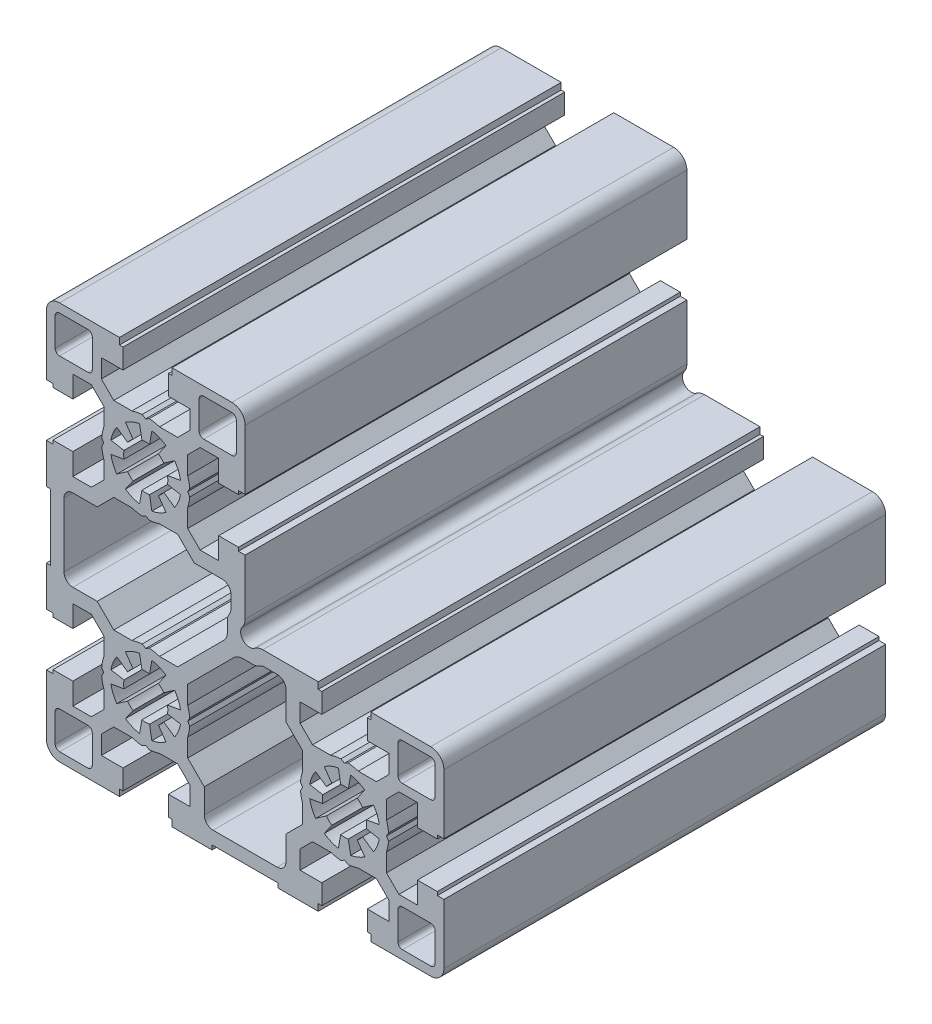
from build123d import *

# Parameters (mm, degrees)
EXTRUDE_1_DEPTH = 100


with BuildPart() as part:
    # Model → Бобышка-Вытянуть1 (new body)
    with BuildSketch(Plane.XY):
        with BuildLine():
            Line((38.010050507, -18.339949491), (42.510050507, -18.339949491))
            Line((42.510050507, -18.339949491), (42.510050507, -17.539949491))
            Line((42.510050507, -17.539949491), (44.010050496, -17.539949491))
            Line((44.010050496, -17.539949491), (44.010050496, -3.989729723))
            ThreePointArc((44.010050496, -3.989729723), (43.131293145, -1.868551453), (41.010050504, -0.989949496))
            Line((41.010050504, -0.989949496), (27.460050496, -0.989949496))
            Line((27.460050496, -0.989949496), (27.460050496, -2.489949483))
            Line((27.460050496, -2.489949483), (26.660050495, -2.489949483))
            Line((26.660050495, -2.489949483), (26.660050495, -6.989949483))
            Line((26.660050495, -6.989949483), (31.560050509, -6.989949483))
            Line((31.560050509, -6.989949483), (31.560050509, -11.177207783))
            Line((31.560050509, -11.177207783), (28.747308809, -13.989949483))
            Line((28.747308809, -13.989949483), (24.632549509, -13.989949483))
            ThreePointArc((24.632549509, -13.989949483), (23.489741508, -13.68786687), (22.319271998, -13.522745231))
            Line((22.319271998, -13.522745231), (21.510050499, -13.989949481))
            Line((21.510050499, -13.989949481), (20.700829, -13.522745231))
            ThreePointArc((20.700829, -13.522745231), (19.530359499, -13.687866869), (18.387551508, -13.989949479))
            Line((18.387551508, -13.989949479), (14.272792208, -13.989949479))
            Line((14.272792208, -13.989949479), (11.460050508, -11.177207779))
            Line((11.460050508, -11.177207779), (11.460050508, -6.989949479))
            Line((11.460050508, -6.989949479), (16.360050501, -6.989949479))
            Line((16.360050501, -6.989949479), (16.360050501, -2.489949483))
            Line((16.360050501, -2.489949483), (15.560050496, -2.489949483))
            Line((15.560050496, -2.489949483), (15.560050496, -0.989949496))
            Line((15.560050496, -0.989949496), (3.013354114, -0.989949496))
            ThreePointArc((3.013354114, -0.989949496), (2.059915363, -1.14548917), (1.205341646, -1.595979799))
            ThreePointArc((1.205341646, -1.595979799), (-1.414213563, -1.414213562), (-1.595979798, 1.205341647))
            ThreePointArc((-1.595979798, 1.205341647), (-1.145489169, 2.059915365), (-0.989949495, 3.013354117))
            Line((-0.989949495, 3.013354117), (-0.989949495, 15.560050504))
            Line((-0.989949495, 15.560050504), (-2.489949491, 15.560050504))
            Line((-2.489949491, 15.560050504), (-2.489949491, 16.360050504))
            Line((-2.489949491, 16.360050504), (-6.989949491, 16.360050504))
            Line((-6.989949491, 16.360050504), (-6.989949491, 11.460050507))
            Line((-6.989949491, 11.460050507), (-11.177207795, 11.460050507))
            Line((-11.177207795, 11.460050507), (-13.989949495, 14.272792207))
            Line((-13.989949495, 14.272792207), (-13.989949495, 18.387551507))
            ThreePointArc((-13.989949495, 18.387551507), (-13.687866882, 19.530359507), (-13.522745244, 20.700829017))
            Line((-13.522745244, 20.700829017), (-13.989949494, 21.510050516))
            Line((-13.989949494, 21.510050516), (-13.522745244, 22.319272015))
            ThreePointArc((-13.522745244, 22.319272015), (-13.687866882, 23.489741516), (-13.989949493, 24.632549507))
            Line((-13.989949493, 24.632549507), (-13.989949493, 28.747308807))
            Line((-13.989949493, 28.747308807), (-11.177207793, 31.560050507))
            Line((-11.177207793, 31.560050507), (-6.989949493, 31.560050507))
            Line((-6.989949493, 31.560050507), (-6.989949493, 26.660050503))
            Line((-6.989949493, 26.660050503), (-2.489949489, 26.660050503))
            Line((-2.489949489, 26.660050503), (-2.489949489, 27.460050504))
            Line((-2.489949489, 27.460050504), (-0.989949496, 27.460050504))
            Line((-0.989949496, 27.460050504), (-0.989949496, 41.010050504))
            ThreePointArc((-0.989949496, 41.010050504), (-1.868629152, 43.131370847), (-3.989949496, 44.010050504))
            Line((-3.989949496, 44.010050504), (-17.539949496, 44.010050504))
            Line((-17.539949496, 44.010050504), (-17.539949496, 42.510050507))
            Line((-17.539949496, 42.510050507), (-18.339949496, 42.510050507))
            Line((-18.339949496, 42.510050507), (-18.339949496, 38.010050507))
            Line((-18.339949496, 38.010050507), (-13.439949492, 38.010050507))
            Line((-13.439949492, 38.010050507), (-13.439949492, 33.822792209))
            Line((-13.439949492, 33.822792209), (-16.252691192, 31.010050509))
            Line((-16.252691192, 31.010050509), (-20.36745051, 31.010050509))
            ThreePointArc((-20.36745051, 31.010050509), (-21.510258502, 31.312133119), (-22.680728004, 31.477254755))
            Line((-22.680728004, 31.477254755), (-23.489949502, 31.010050505))
            Line((-23.489949502, 31.010050505), (-24.299171001, 31.477254755))
            ThreePointArc((-24.299171001, 31.477254755), (-25.469640502, 31.312133117), (-26.612448493, 31.010050506))
            Line((-26.612448493, 31.010050506), (-30.727207793, 31.010050506))
            Line((-30.727207793, 31.010050506), (-33.539949493, 33.822792206))
            Line((-33.539949493, 33.822792206), (-33.539949493, 38.010050506))
            Line((-33.539949493, 38.010050506), (-28.639949493, 38.010050506))
            Line((-28.639949493, 38.010050506), (-28.639949493, 42.510050507))
            Line((-28.639949493, 42.510050507), (-29.439949496, 42.510050507))
            Line((-29.439949496, 42.510050507), (-29.439949496, 44.010050504))
            Line((-29.439949496, 44.010050504), (-42.989949496, 44.010050504))
            ThreePointArc((-42.989949496, 44.010050504), (-45.111269839, 43.131370847), (-45.989949496, 41.010050504))
            Line((-45.989949496, 41.010050504), (-45.989949496, 27.460050504))
            Line((-45.989949496, 27.460050504), (-44.489949499, 27.460050504))
            Line((-44.489949499, 27.460050504), (-44.489949499, 26.660050503))
            Line((-44.489949499, 26.660050503), (-39.989949499, 26.660050503))
            Line((-39.989949499, 26.660050503), (-39.989949499, 31.560050507))
            Line((-39.989949499, 31.560050507), (-35.802691195, 31.560050507))
            Line((-35.802691195, 31.560050507), (-32.989949495, 28.747308807))
            Line((-32.989949495, 28.747308807), (-32.989949495, 24.632549507))
            ThreePointArc((-32.989949495, 24.632549507), (-33.292032106, 23.489741516), (-33.457153745, 22.319272015))
            Line((-33.457153745, 22.319272015), (-32.989949494, 21.510050516))
            Line((-32.989949494, 21.510050516), (-33.457153745, 20.700829017))
            ThreePointArc((-33.457153745, 20.700829017), (-33.292032106, 19.530359507), (-32.989949493, 18.387551507))
            Line((-32.989949493, 18.387551507), (-32.989949493, 14.272792207))
            Line((-32.989949493, 14.272792207), (-35.802691193, 11.460050507))
            Line((-35.802691193, 11.460050507), (-39.989949497, 11.460050507))
            Line((-39.989949497, 11.460050507), (-39.989949497, 16.360050504))
            Line((-39.989949497, 16.360050504), (-44.4899495, 16.360050504))
            Line((-44.4899495, 16.360050504), (-44.4899495, 15.560050504))
            Line((-44.4899495, 15.560050504), (-45.989949497, 15.560050504))
            Line((-45.989949497, 15.560050504), (-45.989949497, 6.510050501))
            Line((-45.989949497, 6.510050501), (-44.989949496, 6.510050501))
            Line((-44.989949496, 6.510050501), (-44.989949496, -8.489949499))
            Line((-44.989949496, -8.489949499), (-45.989949496, -8.489949499))
            Line((-45.989949496, -8.489949499), (-45.989949496, -17.539949502))
            Line((-45.989949496, -17.539949502), (-44.4899495, -17.539949502))
            Line((-44.4899495, -17.539949502), (-44.4899495, -18.339949502))
            Line((-44.4899495, -18.339949502), (-39.9899495, -18.339949502))
            Line((-39.9899495, -18.339949502), (-39.9899495, -13.439949499))
            Line((-39.9899495, -13.439949499), (-35.802691196, -13.439949499))
            Line((-35.802691196, -13.439949499), (-32.989949496, -16.252691199))
            Line((-32.989949496, -16.252691199), (-32.989949496, -20.367450499))
            ThreePointArc((-32.989949496, -20.367450499), (-33.292604606, -21.510173501), (-33.457584039, -22.680727968))
            Line((-33.457584039, -22.680727968), (-32.990379788, -23.489949467))
            Line((-32.990379788, -23.489949467), (-33.457584039, -24.299170966))
            ThreePointArc((-33.457584039, -24.299170966), (-33.292326001, -25.470315713), (-32.989949495, -26.613757309))
            Line((-32.989949495, -26.613757309), (-32.989949495, -30.727207799))
            Line((-32.989949495, -30.727207799), (-35.802691195, -33.539949499))
            Line((-35.802691195, -33.539949499), (-39.989949499, -33.539949499))
            Line((-39.989949499, -33.539949499), (-39.989949499, -28.639949501))
            Line((-39.989949499, -28.639949501), (-44.489949499, -28.639949501))
            Line((-44.489949499, -28.639949501), (-44.489949499, -29.439949502))
            Line((-44.489949499, -29.439949502), (-45.989949496, -29.439949502))
            Line((-45.989949496, -29.439949502), (-45.989949496, -42.989949496))
            ThreePointArc((-45.989949496, -42.989949496), (-45.111269839, -45.11126984), (-42.989949496, -45.989949496))
            Line((-42.989949496, -45.989949496), (-29.439949498, -45.989949496))
            Line((-29.439949498, -45.989949496), (-29.439949498, -44.489949503))
            Line((-29.439949498, -44.489949503), (-28.639949497, -44.489949503))
            Line((-28.639949497, -44.489949503), (-28.639949497, -39.989949499))
            Line((-28.639949497, -39.989949499), (-33.539949492, -39.989949499))
            Line((-33.539949492, -39.989949499), (-33.539949492, -35.802691195))
            Line((-33.539949492, -35.802691195), (-30.727207792, -32.989949495))
            Line((-30.727207792, -32.989949495), (-26.612448492, -32.989949495))
            ThreePointArc((-26.612448492, -32.989949495), (-25.469640502, -33.292032106), (-24.299171002, -33.457153745))
            Line((-24.299171002, -33.457153745), (-23.489949503, -32.989949494))
            Line((-23.489949503, -32.989949494), (-22.680728005, -33.457153745))
            ThreePointArc((-22.680728005, -33.457153745), (-21.510258513, -33.29203211), (-20.367450531, -32.989949505))
            Line((-20.367450531, -32.989949505), (-16.252691194, -32.989949505))
            Line((-16.252691194, -32.989949505), (-13.439949494, -35.802691205))
            Line((-13.439949494, -35.802691205), (-13.439949494, -39.989949509))
            Line((-13.439949494, -39.989949509), (-18.339949497, -39.989949509))
            Line((-18.339949497, -39.989949509), (-18.339949497, -44.489949509))
            Line((-18.339949497, -44.489949509), (-17.539949497, -44.489949509))
            Line((-17.539949497, -44.489949509), (-17.539949497, -45.989949505))
            Line((-17.539949497, -45.989949505), (-8.489949494, -45.989949505))
            Line((-8.489949494, -45.989949505), (-8.489949494, -44.989949505))
            Line((-8.489949494, -44.989949505), (6.510050506, -44.989949505))
            Line((6.510050506, -44.989949505), (6.510050506, -45.989949505))
            Line((6.510050506, -45.989949505), (15.560050497, -45.989949505))
            Line((15.560050497, -45.989949505), (15.560050497, -44.489949508))
            Line((15.560050497, -44.489949508), (16.360050497, -44.489949508))
            Line((16.360050497, -44.489949508), (16.360050497, -39.989949477))
            Line((16.360050497, -39.989949477), (11.460050508, -39.989949477))
            Line((11.460050508, -39.989949477), (11.460050508, -35.802691177))
            Line((11.460050508, -35.802691177), (14.272792208, -32.989949477))
            Line((14.272792208, -32.989949477), (18.387551508, -32.989949477))
            ThreePointArc((18.387551508, -32.989949477), (19.530358922, -33.29203497), (20.70082901, -33.457153726))
            Line((20.70082901, -33.457153726), (21.510050509, -32.989949476))
            Line((21.510050509, -32.989949476), (22.319272008, -33.457153726))
            ThreePointArc((22.319272008, -33.457153726), (23.489741505, -33.292032088), (24.632549493, -32.989949479))
            Line((24.632549493, -32.989949479), (28.747308808, -32.989949479))
            Line((28.747308808, -32.989949479), (31.560050508, -35.802691179))
            Line((31.560050508, -35.802691179), (31.560050508, -39.989949504))
            Line((31.560050508, -39.989949504), (26.660050495, -39.989949504))
            Line((26.660050495, -39.989949504), (26.660050495, -44.489949499))
            Line((26.660050495, -44.489949499), (27.460050496, -44.489949499))
            Line((27.460050496, -44.489949499), (27.460050496, -45.989949496))
            Line((27.460050496, -45.989949496), (41.010050504, -45.989949496))
            ThreePointArc((41.010050504, -45.989949496), (43.131370848, -45.11126984), (44.010050504, -42.989949496))
            Line((44.010050504, -42.989949496), (44.010050504, -29.439949491))
            Line((44.010050504, -29.439949491), (42.510050506, -29.439949491))
            Line((42.510050506, -29.439949491), (42.510050506, -28.63994949))
            Line((42.510050506, -28.63994949), (38.01005051, -28.63994949))
            Line((38.01005051, -28.63994949), (38.01005051, -33.53994948))
            Line((38.01005051, -33.53994948), (33.82279221, -33.53994948))
            Line((33.82279221, -33.53994948), (31.01005051, -30.72720778))
            Line((31.01005051, -30.72720778), (31.01005051, -26.61244848))
            ThreePointArc((31.01005051, -26.61244848), (31.312133122, -25.469640479), (31.477254759, -24.299170968))
            Line((31.477254759, -24.299170968), (31.010050509, -23.489949469))
            Line((31.010050509, -23.489949469), (31.477254759, -22.68072797))
            ThreePointArc((31.477254759, -22.68072797), (31.312133119, -21.51025847), (31.010050507, -20.367450479))
            Line((31.010050507, -20.367450479), (31.010050507, -16.252691179))
            Line((31.010050507, -16.252691179), (33.822792207, -13.439949479))
            Line((33.822792207, -13.439949479), (38.010050507, -13.439949479))
            Line((38.010050507, -13.439949479), (38.010050507, -18.339949491))
        make_face()
        with BuildLine():
            Line((41.010050504, -11.389949496), (34.610050504, -11.389949496))
            ThreePointArc((34.610050504, -11.389949496), (33.902943723, -11.097056278), (33.610050504, -10.389949496))
            Line((33.610050504, -10.389949496), (33.610050504, -3.989949496))
            ThreePointArc((33.610050504, -3.989949496), (33.902943723, -3.282842715), (34.610050504, -2.989949496))
            Line((34.610050504, -2.989949496), (41.010050504, -2.989949496))
            ThreePointArc((41.010050504, -2.989949496), (41.717157285, -3.282842715), (42.010050504, -3.989949496))
            Line((42.010050504, -3.989949496), (42.010050504, -10.389949496))
            ThreePointArc((42.010050504, -10.389949496), (41.717157285, -11.097056278), (41.010050504, -11.389949496))
        make_face(mode=Mode.SUBTRACT)
        with BuildLine():
            Line((-43.989949496, -42.989949496), (-43.989949496, -36.589949496))
            ThreePointArc((-43.989949496, -36.589949496), (-43.697056277, -35.882842715), (-42.989949496, -35.589949496))
            Line((-42.989949496, -35.589949496), (-36.589949496, -35.589949496))
            ThreePointArc((-36.589949496, -35.589949496), (-35.882842715, -35.882842715), (-35.589949496, -36.589949496))
            Line((-35.589949496, -36.589949496), (-35.589949496, -42.989949496))
            ThreePointArc((-35.589949496, -42.989949496), (-35.882842715, -43.697056278), (-36.589949496, -43.989949496))
            Line((-36.589949496, -43.989949496), (-42.989949496, -43.989949496))
            ThreePointArc((-42.989949496, -43.989949496), (-43.697056277, -43.697056278), (-43.989949496, -42.989949496))
        make_face(mode=Mode.SUBTRACT)
        with BuildLine():
            Line((-19.394189275, -20.622067323), (-16.936733145, -18.901338013))
            ThreePointArc((-16.936733145, -18.901338013), (-16.098913239, -20.428482045), (-15.611487474, -22.100764083))
            Line((-15.611487474, -22.100764083), (-18.565910735, -22.621708613))
            ThreePointArc((-18.565910735, -22.621708613), (-18.489949499, -23.489949503), (-18.565910735, -24.358190393))
            Line((-18.565910735, -24.358190393), (-15.611487475, -24.879134923))
            ThreePointArc((-15.611487475, -24.879134923), (-16.098913239, -26.551416961), (-16.936733145, -28.078560993))
            Line((-16.936733145, -28.078560993), (-19.394189275, -26.357831683))
            ThreePointArc((-19.394189275, -26.357831683), (-19.95441559, -27.025483407), (-20.622067315, -27.585709723))
            Line((-20.622067315, -27.585709723), (-18.901338005, -30.043165853))
            ThreePointArc((-18.901338005, -30.043165853), (-20.428482037, -30.880985759), (-22.100764075, -31.368411523))
            Line((-22.100764075, -31.368411523), (-22.621708605, -28.413988263))
            ThreePointArc((-22.621708605, -28.413988263), (-23.489949495, -28.489949498), (-24.358190385, -28.413988263))
            Line((-24.358190385, -28.413988263), (-24.879134915, -31.368411523))
            ThreePointArc((-24.879134915, -31.368411523), (-26.551416953, -30.880985759), (-28.078560985, -30.043165853))
            Line((-28.078560985, -30.043165853), (-26.357831675, -27.585709723))
            ThreePointArc((-26.357831675, -27.585709723), (-27.025483399, -27.025483407), (-27.585709715, -26.357831683))
            Line((-27.585709715, -26.357831683), (-30.043165845, -28.078560993))
            ThreePointArc((-30.043165845, -28.078560993), (-30.880985751, -26.551416961), (-31.368411515, -24.879134923))
            Line((-31.368411515, -24.879134923), (-28.413988255, -24.358190393))
            ThreePointArc((-28.413988255, -24.358190393), (-28.48994949, -23.489949503), (-28.413988255, -22.621708613))
            Line((-28.413988255, -22.621708613), (-31.368411515, -22.100764083))
            ThreePointArc((-31.368411515, -22.100764083), (-30.880985751, -20.428482045), (-30.043165844, -18.901338013))
            Line((-30.043165844, -18.901338013), (-27.585709715, -20.622067323))
            ThreePointArc((-27.585709715, -20.622067323), (-27.025483399, -19.954415599), (-26.357831675, -19.394189283))
            Line((-26.357831675, -19.394189283), (-28.078560985, -16.936733153))
            ThreePointArc((-28.078560985, -16.936733153), (-26.551416953, -16.098913247), (-24.879134915, -15.611487483))
            Line((-24.879134915, -15.611487483), (-24.358190385, -18.565910743))
            ThreePointArc((-24.358190385, -18.565910743), (-23.489949495, -18.489949508), (-22.621708605, -18.565910743))
            Line((-22.621708605, -18.565910743), (-22.100764075, -15.611487483))
            ThreePointArc((-22.100764075, -15.611487483), (-20.428482037, -16.098913247), (-18.901338005, -16.936733153))
            Line((-18.901338005, -16.936733153), (-20.622067315, -19.394189283))
            ThreePointArc((-20.622067315, -19.394189283), (-19.95441559, -19.954415599), (-19.394189275, -20.622067323))
        make_face(mode=Mode.SUBTRACT)
        with BuildLine():
            Line((-10.389949496, 42.010050504), (-3.989949496, 42.010050504))
            ThreePointArc((-3.989949496, 42.010050504), (-3.282842715, 41.717157285), (-2.989949496, 41.010050504))
            Line((-2.989949496, 41.010050504), (-2.989949496, 34.610050504))
            ThreePointArc((-2.989949496, 34.610050504), (-3.282842715, 33.902943722), (-3.989949496, 33.610050504))
            Line((-3.989949496, 33.610050504), (-10.389949496, 33.610050504))
            ThreePointArc((-10.389949496, 33.610050504), (-11.097056277, 33.902943722), (-11.389949496, 34.610050504))
            Line((-11.389949496, 34.610050504), (-11.389949496, 41.010050504))
            ThreePointArc((-11.389949496, 41.010050504), (-11.097056277, 41.717157285), (-10.389949496, 42.010050504))
        make_face(mode=Mode.SUBTRACT)
        with BuildLine():
            Line((-20.622067313, 17.414290287), (-18.901338003, 14.956834157))
            ThreePointArc((-18.901338003, 14.956834157), (-20.428482035, 14.11901425), (-22.100764073, 13.631588486))
            Line((-22.100764073, 13.631588486), (-22.621708603, 16.586011747))
            ThreePointArc((-22.621708603, 16.586011747), (-23.489949493, 16.510050511), (-24.358190383, 16.586011747))
            Line((-24.358190383, 16.586011747), (-24.879134913, 13.631588487))
            ThreePointArc((-24.879134913, 13.631588487), (-26.551416951, 14.119014251), (-28.078560983, 14.956834157))
            Line((-28.078560983, 14.956834157), (-26.357831673, 17.414290287))
            ThreePointArc((-26.357831673, 17.414290287), (-27.025483398, 17.974516602), (-27.585709713, 18.642168327))
            Line((-27.585709713, 18.642168327), (-30.043165843, 16.921439017))
            ThreePointArc((-30.043165843, 16.921439017), (-30.880985749, 18.448583049), (-31.368411514, 20.120865087))
            Line((-31.368411514, 20.120865087), (-28.413988253, 20.641809617))
            ThreePointArc((-28.413988253, 20.641809617), (-28.489949489, 21.510050507), (-28.413988253, 22.378291397))
            Line((-28.413988253, 22.378291397), (-31.368411513, 22.899235927))
            ThreePointArc((-31.368411513, 22.899235927), (-30.880985749, 24.571517964), (-30.043165843, 26.098661996))
            Line((-30.043165843, 26.098661996), (-27.585709713, 24.377932687))
            ThreePointArc((-27.585709713, 24.377932687), (-27.025483398, 25.045584411), (-26.357831673, 25.605810727))
            Line((-26.357831673, 25.605810727), (-28.078560983, 28.063266857))
            ThreePointArc((-28.078560983, 28.063266857), (-26.551416951, 28.901086763), (-24.879134913, 29.388512527))
            Line((-24.879134913, 29.388512527), (-24.358190383, 26.434089267))
            ThreePointArc((-24.358190383, 26.434089267), (-23.489949493, 26.510050502), (-22.621708603, 26.434089267))
            Line((-22.621708603, 26.434089267), (-22.100764073, 29.388512527))
            ThreePointArc((-22.100764073, 29.388512527), (-20.428482035, 28.901086763), (-18.901338003, 28.063266856))
            Line((-18.901338003, 28.063266856), (-20.622067313, 25.605810727))
            ThreePointArc((-20.622067313, 25.605810727), (-19.954415589, 25.045584411), (-19.394189273, 24.377932687))
            Line((-19.394189273, 24.377932687), (-16.936733143, 26.098661997))
            ThreePointArc((-16.936733143, 26.098661997), (-16.098913237, 24.571517965), (-15.611487473, 22.899235927))
            Line((-15.611487473, 22.899235927), (-18.565910733, 22.378291397))
            ThreePointArc((-18.565910733, 22.378291397), (-18.489949498, 21.510050507), (-18.565910733, 20.641809617))
            Line((-18.565910733, 20.641809617), (-15.611487473, 20.120865087))
            ThreePointArc((-15.611487473, 20.120865087), (-16.098913237, 18.448583049), (-16.936733144, 16.921439017))
            Line((-16.936733144, 16.921439017), (-19.394189273, 18.642168327))
            ThreePointArc((-19.394189273, 18.642168327), (-19.954415589, 17.974516602), (-20.622067313, 17.414290287))
        make_face(mode=Mode.SUBTRACT)
        with BuildLine():
            Line((-42.989949496, 42.010050504), (-36.589949496, 42.010050504))
            ThreePointArc((-36.589949496, 42.010050504), (-35.882842715, 41.717157285), (-35.589949496, 41.010050504))
            Line((-35.589949496, 41.010050504), (-35.589949496, 34.610050504))
            ThreePointArc((-35.589949496, 34.610050504), (-35.882842715, 33.902943722), (-36.589949496, 33.610050504))
            Line((-36.589949496, 33.610050504), (-42.989949496, 33.610050504))
            ThreePointArc((-42.989949496, 33.610050504), (-43.697056277, 33.902943722), (-43.989949496, 34.610050504))
            Line((-43.989949496, 34.610050504), (-43.989949496, 41.010050504))
            ThreePointArc((-43.989949496, 41.010050504), (-43.697056277, 41.717157285), (-42.989949496, 42.010050504))
        make_face(mode=Mode.SUBTRACT)
        with BuildLine():
            Line((-13.989949499, -16.252691194), (-3.605887459, -5.868629154))
            ThreePointArc((-3.605887459, -5.868629154), (-2.632617412, -5.218310901), (-1.484567115, -4.9899495))
            Line((-1.484567115, -4.9899495), (0.92372853, -4.9899495))
            ThreePointArc((0.92372853, -4.9899495), (1.43706441, -4.922948795), (1.916006424, -4.726435774))
            Line((1.916006424, -4.726435774), (2.393708386, -4.453463218))
            ThreePointArc((2.393708386, -4.453463218), (2.8726504, -4.256950197), (3.38598628, -4.189949492))
            Line((3.38598628, -4.189949492), (6.259620203, -4.189949492))
            ThreePointArc((6.259620203, -4.189949492), (7.673833765, -4.775735929), (8.259620203, -6.189949489))
            Line((8.259620203, -6.189949489), (8.259620203, -12.502260889))
            Line((8.259620203, -12.502260889), (12.010050503, -16.252691189))
            Line((12.010050503, -16.252691189), (12.010050503, -20.367450489))
            ThreePointArc((12.010050503, -20.367450489), (11.707967892, -21.510258481), (11.542846253, -22.680727982))
            Line((11.542846253, -22.680727982), (12.010050503, -23.48994948))
            Line((12.010050503, -23.48994948), (11.542846253, -24.299170979))
            ThreePointArc((11.542846253, -24.299170979), (11.707967891, -25.46964049), (12.010050504, -26.61244849))
            Line((12.010050504, -26.61244849), (12.010050504, -30.727207793))
            Line((12.010050504, -30.727207793), (8.259620204, -34.477638093))
            Line((8.259620204, -34.477638093), (8.259620204, -39.989949493))
            ThreePointArc((8.259620204, -39.989949493), (7.673833767, -41.404163055), (6.259620204, -41.989949493))
            Line((6.259620204, -41.989949493), (-8.239949496, -41.989949493))
            ThreePointArc((-8.239949496, -41.989949493), (-9.654163058, -41.404163055), (-10.239949496, -39.989949493))
            Line((-10.239949496, -39.989949493), (-10.239949496, -34.477207793))
            Line((-10.239949496, -34.477207793), (-13.989949496, -30.727207793))
            Line((-13.989949496, -30.727207793), (-13.989949496, -26.612448493))
            ThreePointArc((-13.989949496, -26.612448493), (-13.687866884, -25.469640493), (-13.522745247, -24.299170983))
            Line((-13.522745247, -24.299170983), (-13.989949497, -23.489949484))
            Line((-13.989949497, -23.489949484), (-13.522745247, -22.680727985))
            ThreePointArc((-13.522745247, -22.680727985), (-13.687866887, -21.510258485), (-13.989949499, -20.367450494))
            Line((-13.989949499, -20.367450494), (-13.989949499, -16.252691194))
        make_face(mode=Mode.SUBTRACT)
        with BuildLine():
            Line((-23.489949495, -13.989949503), (-24.299170994, -13.522745252))
            ThreePointArc((-24.299170994, -13.522745252), (-25.469640495, -13.68786689), (-26.612448486, -13.9899495))
            Line((-26.612448486, -13.9899495), (-30.727207786, -13.9899495))
            Line((-30.727207786, -13.9899495), (-34.477207786, -10.2399495))
            Line((-34.477207786, -10.2399495), (-39.989949486, -10.2399495))
            ThreePointArc((-39.989949486, -10.2399495), (-41.404163048, -9.654163062), (-41.989949486, -8.2399495))
            Line((-41.989949486, -8.2399495), (-41.989949486, 6.2596202))
            ThreePointArc((-41.989949486, 6.2596202), (-41.404163048, 7.673833762), (-39.989949486, 8.2596202))
            Line((-39.989949486, 8.2596202), (-34.477638086, 8.2596202))
            Line((-34.477638086, 8.2596202), (-30.727207786, 12.0100505))
            Line((-30.727207786, 12.0100505), (-26.612448486, 12.0100505))
            ThreePointArc((-26.612448486, 12.0100505), (-25.469640494, 11.70796789), (-24.299170992, 11.542846252))
            Line((-24.299170992, 11.542846252), (-23.489949493, 12.010050502))
            Line((-23.489949493, 12.010050502), (-22.680727994, 11.542846252))
            ThreePointArc((-22.680727994, 11.542846252), (-21.510258483, 11.707967892), (-20.367450481, 12.010050507))
            Line((-20.367450481, 12.010050507), (-16.252691181, 12.010050507))
            Line((-16.252691181, 12.010050507), (-12.502260881, 8.259620207))
            Line((-12.502260881, 8.259620207), (-6.189949481, 8.259620207))
            ThreePointArc((-6.189949481, 8.259620207), (-4.775735919, 7.673833769), (-4.189949481, 6.259620207))
            Line((-4.189949481, 6.259620207), (-4.189949481, 3.385986287))
            ThreePointArc((-4.189949481, 3.385986287), (-4.256950185, 2.87265041), (-4.453463203, 2.393708399))
            Line((-4.453463203, 2.393708399), (-4.726435767, 1.916006424))
            ThreePointArc((-4.726435767, 1.916006424), (-4.922948786, 1.437064411), (-4.989949491, 0.923728533))
            Line((-4.989949491, 0.923728533), (-4.989949491, -1.484567127))
            ThreePointArc((-4.989949491, -1.484567127), (-5.218310893, -2.632617421), (-5.868629146, -3.605887466))
            Line((-5.868629146, -3.605887466), (-16.252691186, -13.989949506))
            Line((-16.252691186, -13.989949506), (-20.367450486, -13.989949506))
            ThreePointArc((-20.367450486, -13.989949506), (-21.510258486, -13.687866892), (-22.680727996, -13.522745252))
            Line((-22.680727996, -13.522745252), (-23.489949495, -13.989949503))
        make_face(mode=Mode.SUBTRACT)
        with BuildLine():
            Line((24.377932689, -27.5857097), (26.098661997, -30.043165827))
            ThreePointArc((26.098661997, -30.043165827), (24.571517966, -30.880985735), (22.899235928, -31.368411501))
            Line((22.899235928, -31.368411501), (22.378291398, -28.413988238))
            ThreePointArc((22.378291398, -28.413988238), (21.510050508, -28.489949474), (20.641809618, -28.413988239))
            Line((20.641809618, -28.413988239), (20.120865088, -31.368411499))
            ThreePointArc((20.120865088, -31.368411499), (18.44858305, -30.880985735), (16.921439018, -30.043165828))
            Line((16.921439018, -30.043165828), (18.642168327, -27.5857097))
            ThreePointArc((18.642168327, -27.5857097), (17.974516604, -27.025483383), (17.414290289, -26.357831658))
            Line((17.414290289, -26.357831658), (14.956834156, -28.07856097))
            ThreePointArc((14.956834156, -28.07856097), (14.119014252, -26.551416937), (13.63158849, -24.879134899))
            Line((13.63158849, -24.879134899), (16.586011746, -24.358190369))
            ThreePointArc((16.586011746, -24.358190369), (16.510050513, -23.489949479), (16.58601175, -22.621708589))
            Line((16.58601175, -22.621708589), (13.631588486, -22.100764058))
            ThreePointArc((13.631588486, -22.100764058), (14.119014252, -20.428482021), (14.95683416, -18.90133799))
            Line((14.95683416, -18.90133799), (17.414290287, -20.622067298))
            ThreePointArc((17.414290287, -20.622067298), (17.974516604, -19.954415575), (18.642168329, -19.39418926))
            Line((18.642168329, -19.39418926), (16.921439017, -16.936733127))
            ThreePointArc((16.921439017, -16.936733127), (18.44858305, -16.098913223), (20.120865088, -15.61148746))
            Line((20.120865088, -15.61148746), (20.641809618, -18.565910718))
            ThreePointArc((20.641809618, -18.565910718), (21.510050508, -18.489949484), (22.378291398, -18.565910719))
            Line((22.378291398, -18.565910719), (22.899235928, -15.611487459))
            ThreePointArc((22.899235928, -15.611487459), (24.571517966, -16.098913223), (26.098661998, -16.936733129))
            Line((26.098661998, -16.936733129), (24.377932687, -19.39418926))
            ThreePointArc((24.377932687, -19.39418926), (25.045584412, -19.954415575), (25.605810729, -20.622067298))
            Line((25.605810729, -20.622067298), (28.063266856, -18.90133799))
            ThreePointArc((28.063266856, -18.90133799), (28.901086764, -20.428482021), (29.38851253, -22.100764058))
            Line((29.38851253, -22.100764058), (26.434089266, -22.621708589))
            ThreePointArc((26.434089266, -22.621708589), (26.510050503, -23.489949479), (26.43408927, -24.358190369))
            Line((26.43408927, -24.358190369), (29.388512526, -24.879134898))
            ThreePointArc((29.388512526, -24.879134898), (28.901086764, -26.551416937), (28.06326686, -28.07856097))
            Line((28.06326686, -28.07856097), (25.605810727, -26.357831658))
            ThreePointArc((25.605810727, -26.357831658), (25.045584412, -27.025483383), (24.377932689, -27.5857097))
        make_face(mode=Mode.SUBTRACT)
        with BuildLine():
            Line((41.010050504, -43.989949496), (34.610050504, -43.989949496))
            ThreePointArc((34.610050504, -43.989949496), (33.902943723, -43.697056278), (33.610050504, -42.989949496))
            Line((33.610050504, -42.989949496), (33.610050504, -36.589949496))
            ThreePointArc((33.610050504, -36.589949496), (33.902943723, -35.882842715), (34.610050504, -35.589949496))
            Line((34.610050504, -35.589949496), (41.010050504, -35.589949496))
            ThreePointArc((41.010050504, -35.589949496), (41.717157285, -35.882842715), (42.010050504, -36.589949496))
            Line((42.010050504, -36.589949496), (42.010050504, -42.989949496))
            ThreePointArc((42.010050504, -42.989949496), (41.717157285, -43.697056278), (41.010050504, -43.989949496))
        make_face(mode=Mode.SUBTRACT)
    extrude(amount=-EXTRUDE_1_DEPTH)


solid = part.part
